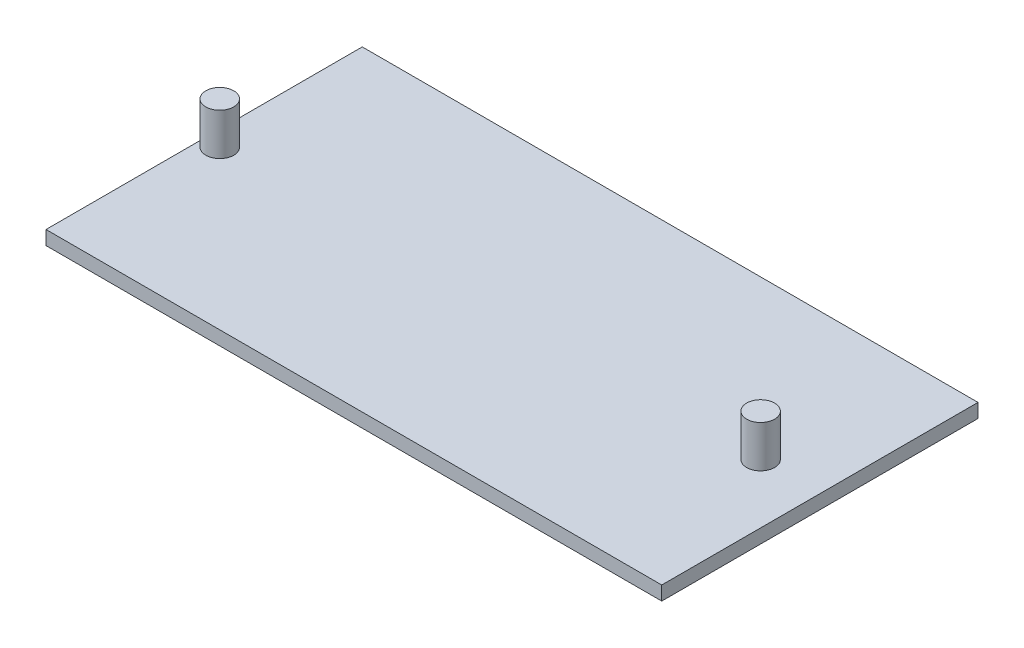
from build123d import *

# Parameters (mm, degrees)
SKETCH1_W             = 139.954
SKETCH1_H             = 71.882
SKETCH1_R             = 4.191
BOSS_EXTRUDE1_DEPTH   = 3.175
SKETCH2_R             = 3.175
BOSS_EXTRUDE4_DEPTH   = 12.7
BOSS_EXTRUDE4_2_DEPTH = 12.7
SKETCH1_7_R           = 4.191
BOSS_EXTRUDE5_DEPTH   = 3.175
BOSS_EXTRUDE6_START   = -3.175
SKETCH14_R            = 4.191
BOSS_EXTRUDE6_DEPTH   = 3.175
SKETCH15_W            = 71.882
SKETCH15_H            = 3.175
CUT_EXTRUDE1_DEPTH    = 2.794
SKETCH16_W            = 71.882
SKETCH16_H            = 3.175
BOSS_EXTRUDE7_DEPTH   = 2.794


with BuildPart() as part:
    # Sketch1 → Boss-Extrude1 (new body)
    with BuildSketch(Plane(origin=(0, 0, 0), x_dir=(1, 0, 0), z_dir=(0, 1, 0))):
        with Locations((69.977, 35.941)):
            Rectangle(SKETCH1_W, SKETCH1_H)
        with Locations((6.35, 35.941)):
            Circle(SKETCH1_R, mode=Mode.SUBTRACT)
        with Locations((129.286, 35.941)):
            Circle(SKETCH1_R, mode=Mode.SUBTRACT)
    extrude(amount=-BOSS_EXTRUDE1_DEPTH)



with BuildPart() as body_2:
    # Sketch2 → Boss-Extrude4 (new body)
    with BuildSketch(Plane.XZ.offset(3.175)):
        with Locations((6.35, -35.941)):
            Circle(SKETCH2_R)
    extrude(amount=-BOSS_EXTRUDE4_DEPTH)


with BuildPart() as body_3:
    # Sketch2 → Boss-Extrude4 2 (new body)
    with BuildSketch(Plane.XZ.offset(3.175)):
        with Locations((129.286, -35.941)):
            Circle(SKETCH2_R)
    extrude(amount=-BOSS_EXTRUDE4_2_DEPTH)


with BuildPart() as part_1:
    add(part.part)

    add(body_3.part)  # Boss-Extrude5 merges body 3
    # Sketch1<7> → Boss-Extrude5 (add)
    with BuildSketch(Plane(origin=(0, 0, 0), x_dir=(1, 0, 0), z_dir=(0, 1, 0))):
        with Locations((129.286, 35.941)):
            Circle(SKETCH1_7_R)
    extrude(amount=-BOSS_EXTRUDE5_DEPTH)


    add(body_2.part)  # Boss-Extrude6 merges body 2
    # Sketch14 → Boss-Extrude6 (add)
    with BuildSketch(Plane.XZ.offset(3.175).offset(BOSS_EXTRUDE6_START)):
        with Locations((6.35, -35.941)):
            Circle(SKETCH14_R)
    extrude(amount=BOSS_EXTRUDE6_DEPTH)

    # Sketch15 → Cut-Extrude1 (cut)
    with BuildSketch(Plane.ZY):
        with Locations((-35.941, -1.5875)):
            Rectangle(SKETCH15_W, SKETCH15_H)
    extrude(amount=-CUT_EXTRUDE1_DEPTH, mode=Mode.SUBTRACT)

    # Sketch16 → Boss-Extrude7 (add)
    with BuildSketch(Plane(origin=(139.954, 0, 0), x_dir=(0, 0, -1), z_dir=(1, 0, 0))):
        with Locations((35.941, -1.5875)):
            Rectangle(SKETCH16_W, SKETCH16_H)
    extrude(amount=BOSS_EXTRUDE7_DEPTH)


solid = part_1.part
